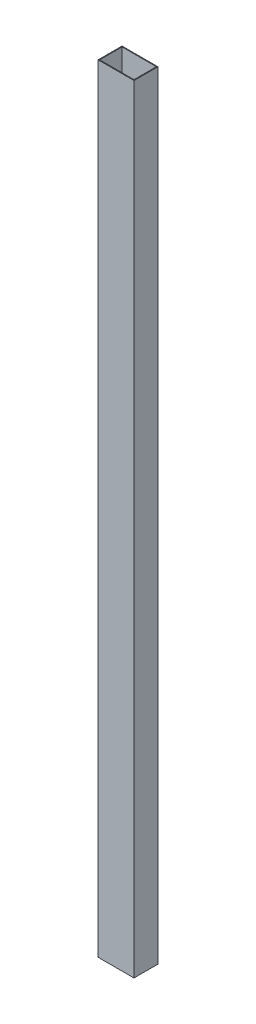
from build123d import *

# Parameters (mm, degrees)
SKETCH1_W           = 76.2
SKETCH1_H           = 50.8
SKETCH1_W_2         = 73.025
SKETCH1_H_2         = 47.625
BOSS_EXTRUDE1_DEPTH = 1651


with BuildPart() as part:
    # Sketch1 → Boss-Extrude1 (new body)
    with BuildSketch(Plane(origin=(0, 0, 0), x_dir=(1, 0, 0), z_dir=(0, 1, 0))):
        with Locations((-38.1, 25.4)):
            Rectangle(SKETCH1_W, SKETCH1_H)
        with Locations((-38.1, 25.4)):
            Rectangle(SKETCH1_W_2, SKETCH1_H_2, mode=Mode.SUBTRACT)
    extrude(amount=BOSS_EXTRUDE1_DEPTH)


solid = part.part
